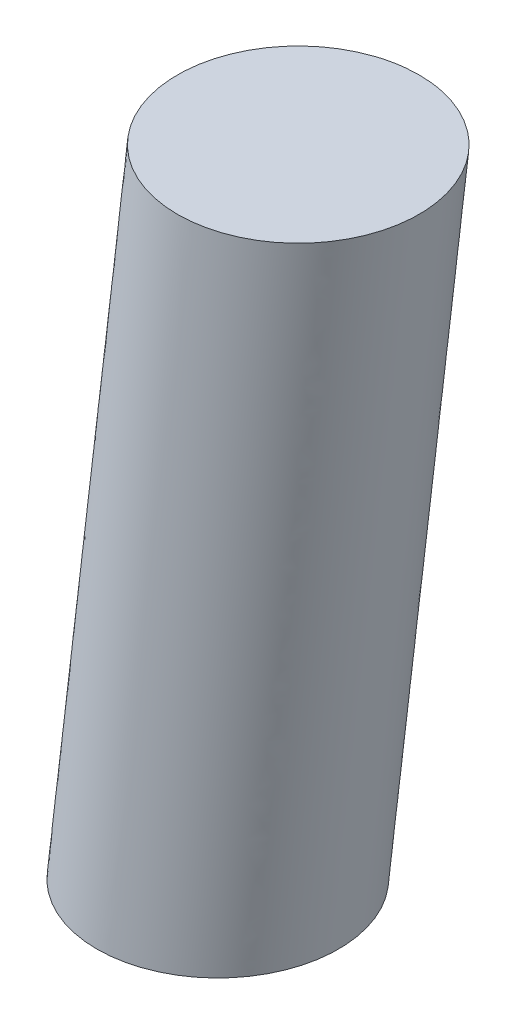
from build123d import *

# Parameters (mm, degrees)
SKETCH_2_R = 37.5


with BuildPart() as part:
    # 掃出1: sweep along a path in 草圖1
    with BuildLine(Plane.XY) as sweep_1_path:
        Line((75, 0), (100, 210))
    # 草圖2 → 掃出1 (sweep)
    with BuildSketch(Plane(origin=(0, 0, 0), x_dir=(1, 0, 0), z_dir=(0, 1, 0))):
        with Locations((75, 0)):
            Circle(SKETCH_2_R)
    sweep(path=sweep_1_path.line)


solid = part.part
